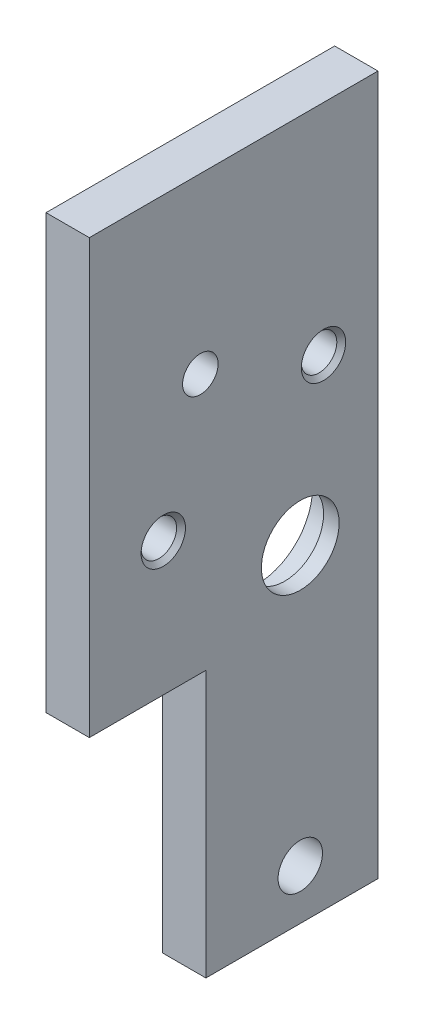
from build123d import *

# Parameters (mm, degrees)
SKETCH1_W                                        = 30
SKETCH1_H                                        = 63
BOSS_EXTRUDE1_DEPTH                              = 3.9
SKETCH2_R                                        = 5
CUT_EXTRUDE1_DEPTH                               = 70.887123277
F_4_0_4_DIAMETER_HOLE1_D                         = 4
SKETCH12_W                                       = 14.5
SKETCH12_H                                       = 24
CUT_EXTRUDE2_DEPTH                               = 70.887123277
CBORE_FOR_M3_PAN_HEAD_MACHINE_SCREW2_D           = 3.2
CBORE_FOR_M3_PAN_HEAD_MACHINE_SCREW2_CBORE_D     = 9
CBORE_FOR_M3_PAN_HEAD_MACHINE_SCREW2_CBORE_DEPTH = 1
CSK_FOR_M3_FLAT_HEAD_MACHINE_SCREW1_D            = 3.2
CSK_FOR_M3_FLAT_HEAD_MACHINE_SCREW1_CSINK_D      = 4
CSK_FOR_M3_FLAT_HEAD_MACHINE_SCREW1_CSINK_ANGLE  = 90
SKETCH19_W                                       = 4
SKETCH19_H                                       = 39
CUT_EXTRUDE3_DEPTH                               = 70.887123277
SKETCH20_R                                       = 5
SKETCH20_R_2                                     = 3.5
BOSS_EXTRUDE2_DEPTH                              = 1.4


with BuildPart() as part:
    # Sketch1 → Boss-Extrude1 (new body)
    with BuildSketch(Plane(origin=(0, 0, 0), x_dir=(0, 0, -1), z_dir=(1, 0, 0))):
        with Locations((-15, 31.5)):
            Rectangle(SKETCH1_W, SKETCH1_H)
    extrude(amount=-BOSS_EXTRUDE1_DEPTH)

    # Sketch2 → Cut-Extrude1 (cut, through all)
    with BuildSketch(Plane(origin=(0, 0, 0), x_dir=(0, 0, -1), z_dir=(1, 0, 0))):
        with Locations((-7, 29.5)):
            Circle(SKETCH2_R)
    extrude(amount=-CUT_EXTRUDE1_DEPTH, mode=Mode.SUBTRACT)

    # Ø4.0 (4) Diameter Hole1 (through all)
    with Locations(Plane(origin=(0, 4.5, 7), x_dir=(0, 0, 1), z_dir=(1, 0, 0))):
        with Locations((0, 0)):
            Hole(F_4_0_4_DIAMETER_HOLE1_D / 2)

    # Sketch12 → Cut-Extrude2 (cut, through all)
    with BuildSketch(Plane(origin=(0, 0, 0), x_dir=(0, 0, -1), z_dir=(1, 0, 0))):
        with Locations((-22.75, 12)):
            Rectangle(SKETCH12_W, SKETCH12_H)
    extrude(amount=-CUT_EXTRUDE2_DEPTH, mode=Mode.SUBTRACT)

    # CBORE for M3 Pan Head Machine Screw2 (through all)
    with Locations(Plane(origin=(-3.9, 47.360571099, 16), x_dir=(0, 0, -1), z_dir=(-1, 0, 0))):
        with Locations((0, 0)):
            CounterBoreHole(CBORE_FOR_M3_PAN_HEAD_MACHINE_SCREW2_D / 2, CBORE_FOR_M3_PAN_HEAD_MACHINE_SCREW2_CBORE_D / 2, CBORE_FOR_M3_PAN_HEAD_MACHINE_SCREW2_CBORE_DEPTH)

    # CSK for M3 Flat Head Machine Screw1 (through all)
    with Locations(Plane(origin=(0, 36.032608687, 19.33966579), x_dir=(0, 0, 1), z_dir=(1, 0, 0))):
        with Locations((0, 0), (-14.431341448, -7.272)):
            CounterSinkHole(CSK_FOR_M3_FLAT_HEAD_MACHINE_SCREW1_D / 2, CSK_FOR_M3_FLAT_HEAD_MACHINE_SCREW1_CSINK_D / 2, counter_sink_angle=CSK_FOR_M3_FLAT_HEAD_MACHINE_SCREW1_CSINK_ANGLE)

    # Sketch19 → Cut-Extrude3 (cut, through all)
    with BuildSketch(Plane.ZY.offset(3.9)):
        with Locations((28, 43.5)):
            Rectangle(SKETCH19_W, SKETCH19_H)
    extrude(amount=-CUT_EXTRUDE3_DEPTH, mode=Mode.SUBTRACT)

    # Sketch20 → Boss-Extrude2 (add)
    with BuildSketch(Plane(origin=(0, 0, 0), x_dir=(0, 0, -1), z_dir=(1, 0, 0))):
        with Locations((-7, 29.5)):
            Circle(SKETCH20_R)
        with Locations((-7, 29.5)):
            Circle(SKETCH20_R_2, mode=Mode.SUBTRACT)
    extrude(amount=-BOSS_EXTRUDE2_DEPTH)


solid = part.part
